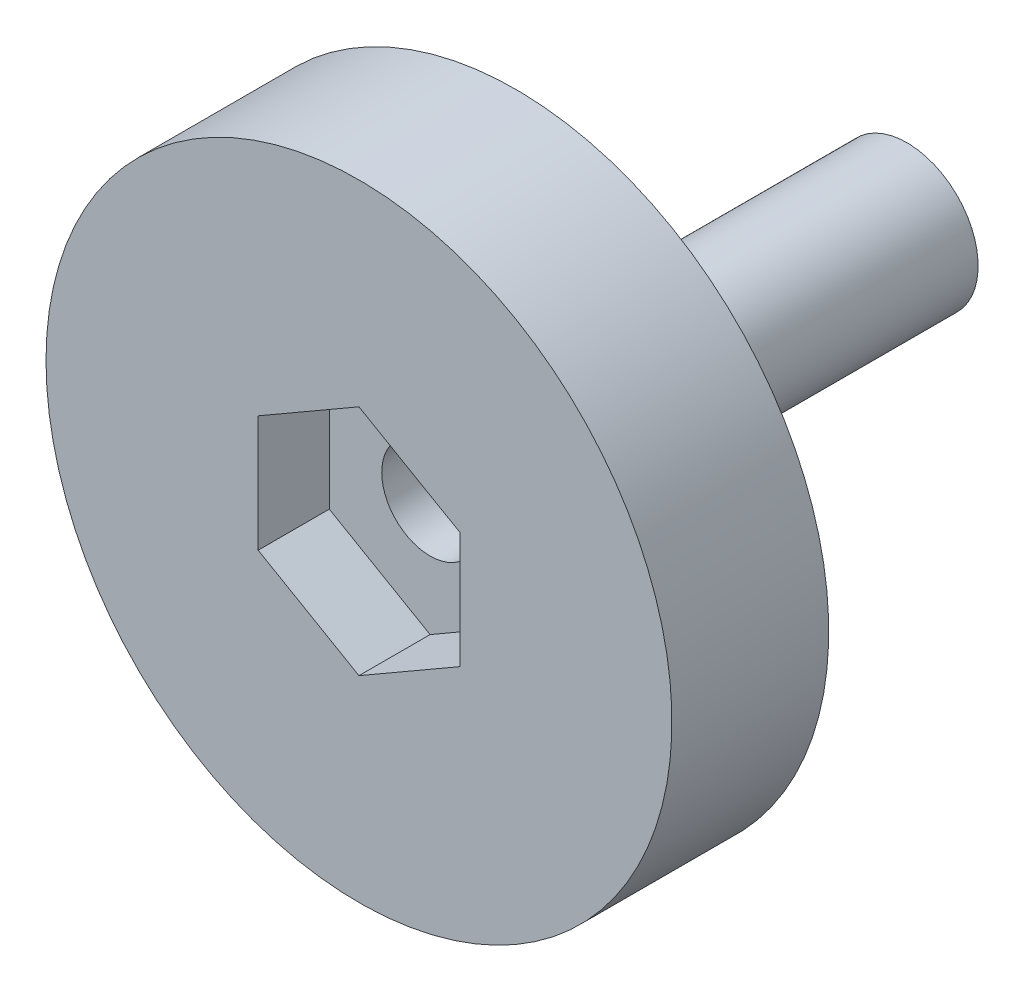
from build123d import *

# Parameters (mm, degrees)
CUT_EXTRUDE1_DEPTH = 3.175


with BuildPart() as part:
    # Sketch2 → Revolve1 (revolve)
    with BuildSketch(Plane(origin=(0, 0, 0), x_dir=(1, 0, 0), z_dir=(0, 1, 0)), mode=Mode.PRIVATE) as revolve1_sk:
        Polygon((-10.617267455, 12.7), (-9.601267455, 12.7), (-9.601267455, 0), (-6.426267455, 0), (-6.426267455, -4.7625), (1.193732545, -4.7625), (1.193732545, -11.7625), (-10.617267455, -11.7625), align=None)
    revolve(revolve1_sk.sketch.rotate(Axis((-12.776267455, 0, -12.7), (0, 0, 1)), 180), axis=Axis((-12.776267455, 0, -12.7), (0, 0, 1)))

    # Sketch3 → Cut-Extrude1 (cut)
    with BuildSketch(Plane.XY.offset(11.7625)):
        Polygon((-12.776267455, -5.196152423), (-8.276267455, -2.598076211), (-8.276267455, 2.598076211), (-12.776267455, 5.196152423), (-17.276267455, 2.598076211), (-17.276267455, -2.598076211), align=None)
    extrude(amount=-CUT_EXTRUDE1_DEPTH, mode=Mode.SUBTRACT)


solid = part.part
